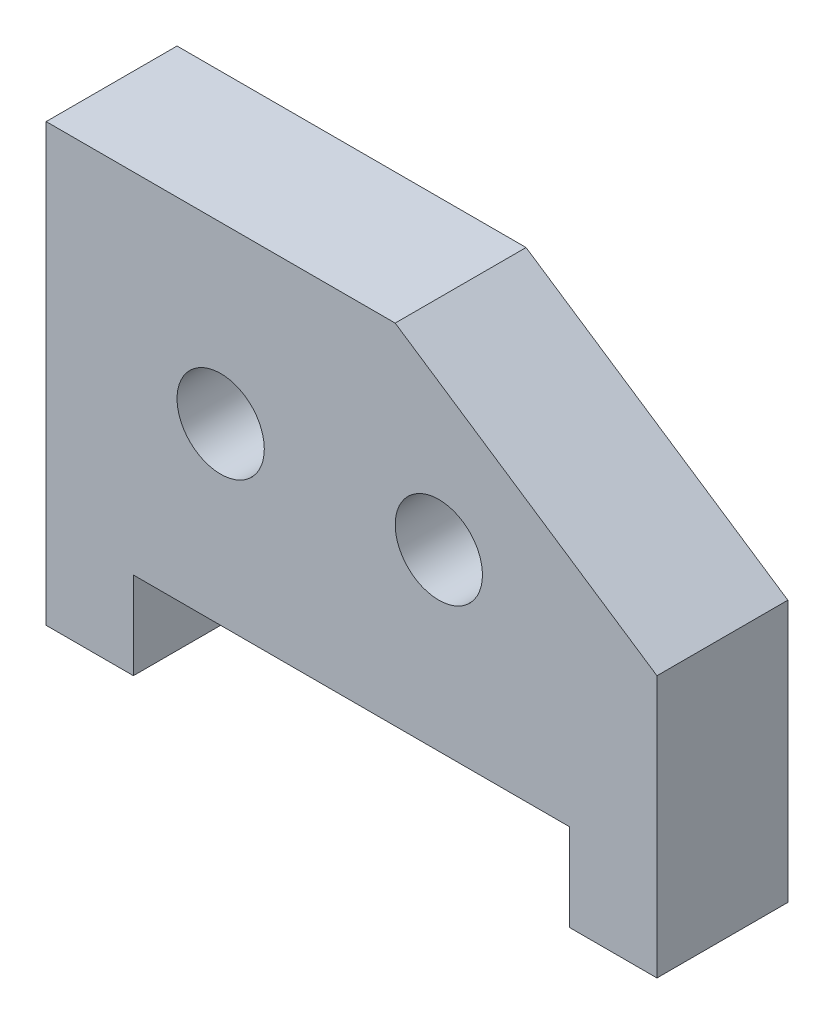
from build123d import *

# Parameters (mm, degrees)
SKETCH1_R           = 25
BOSS_EXTRUDE1_DEPTH = 75


with BuildPart() as part:
    # Sketch1 → Boss-Extrude1 (new body)
    with BuildSketch(Plane.XY):
        Polygon((54.166666667, 104.166666667), (204.166666667, 4.166666667), (204.166666667, -145.833333333), (154.166666667, -145.833333333), (154.166666667, -95.833333333), (-95.833333333, -95.833333333), (-95.833333333, -145.833333333), (-145.833333333, -145.833333333), (-145.833333333, 104.166666667), align=None)
        with Locations((79.166666667, 4.166666667)):
            Circle(SKETCH1_R, mode=Mode.SUBTRACT)
        with Locations((-45.833333333, 4.166666667)):
            Circle(SKETCH1_R, mode=Mode.SUBTRACT)
    extrude(amount=BOSS_EXTRUDE1_DEPTH)


solid = part.part
